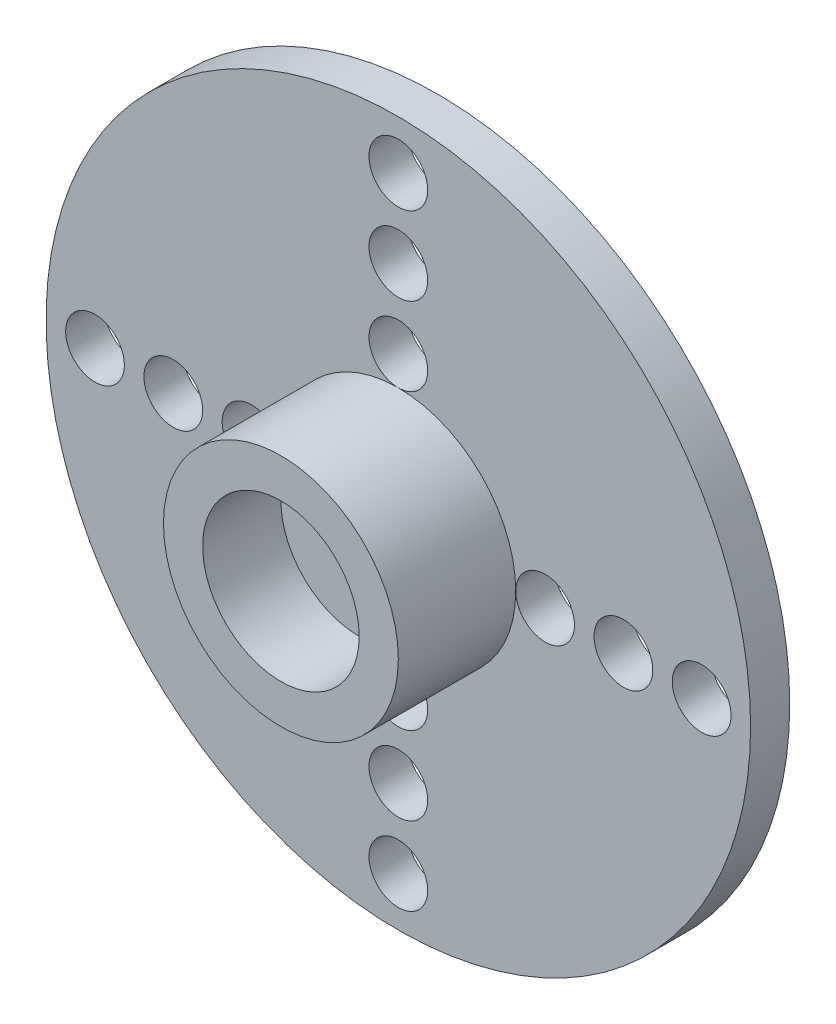
from build123d import *

# Parameters (mm, degrees)
SKETCH1_R           = 9
SKETCH1_R_2         = 3
BOSS_EXTRUDE1_DEPTH = 1
SKETCH1_3_R         = 3
SKETCH1_3_R_2       = 2
BOSS_EXTRUDE2_DEPTH = 4
SKETCH1_4_R         = 2
BOSS_EXTRUDE3_DEPTH = 2
SKETCH2_R           = 0.75
CUT_EXTRUDE1_DEPTH  = 2
SKETCH3_R           = 0.75
CUT_EXTRUDE2_DEPTH  = 14.076696831


with BuildPart() as part:
    # Sketch1 → Boss-Extrude1 (new body)
    with BuildSketch(Plane.XY):
        Circle(SKETCH1_R)
        Circle(SKETCH1_R_2, mode=Mode.SUBTRACT)
    extrude(amount=BOSS_EXTRUDE1_DEPTH)

    # Sketch1<3> → Boss-Extrude2 (add)
    with BuildSketch(Plane.XY):
        Circle(SKETCH1_3_R)
        Circle(SKETCH1_3_R_2, mode=Mode.SUBTRACT)
    extrude(amount=BOSS_EXTRUDE2_DEPTH)

    # Sketch1<4> → Boss-Extrude3 (add)
    with BuildSketch(Plane.XY):
        Circle(SKETCH1_4_R)
    extrude(amount=BOSS_EXTRUDE3_DEPTH)

    # Sketch2 → Cut-Extrude1 (cut)
    with BuildSketch(Plane.XY.offset(2)):
        Circle(SKETCH2_R)
    extrude(amount=-CUT_EXTRUDE1_DEPTH, mode=Mode.SUBTRACT)

    # Sketch3 → Cut-Extrude2 (cut, through all)
    with BuildSketch(Plane.XY.offset(1)):
        with Locations((3.75, 0)):
            Circle(SKETCH3_R)
        with Locations((5.75, 0)):
            Circle(SKETCH3_R)
        with Locations((7.75, 0)):
            Circle(SKETCH3_R)
        with Locations((-3.75, 0)):
            Circle(SKETCH3_R)
        with Locations((-5.75, 0)):
            Circle(SKETCH3_R)
        with Locations((-7.75, 0)):
            Circle(SKETCH3_R)
        with Locations((0, 3.75)):
            Circle(SKETCH3_R)
        with Locations((0, 5.75)):
            Circle(SKETCH3_R)
        with Locations((0, 7.75)):
            Circle(SKETCH3_R)
        with Locations((0, -3.75)):
            Circle(SKETCH3_R)
        with Locations((0, -5.75)):
            Circle(SKETCH3_R)
        with Locations((0, -7.75)):
            Circle(SKETCH3_R)
    extrude(amount=-CUT_EXTRUDE2_DEPTH, mode=Mode.SUBTRACT)


solid = part.part
